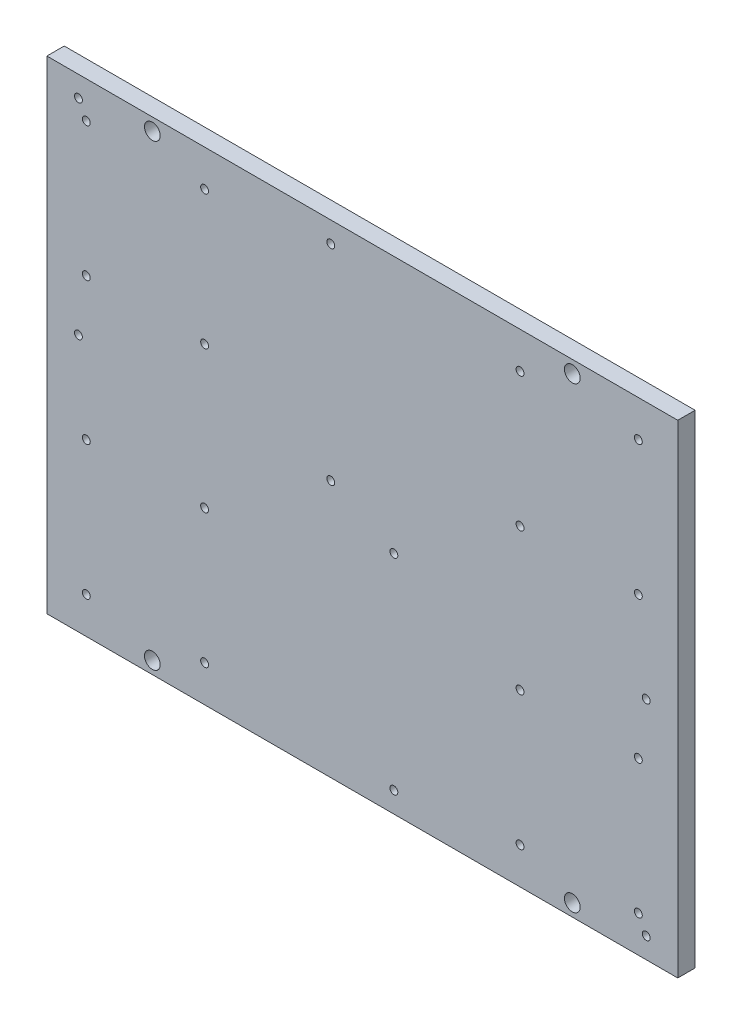
from build123d import *

# Parameters (mm, degrees)
SKETCH1_W             = 203.2
SKETCH1_H             = 155.575
BOSS_EXTRUDE1_DEPTH   = 5.588
SKETCH2_R             = 2.54
CUT_EXTRUDE1_DEPTH    = 129.08075929
SKETCH3_R             = 1.27
H_BRIDGE_MOUNTS_DEPTH = 129.08075929
SKETCH4_R             = 1.27
MOTO_MOUNTS_DEPTH     = 129.08075929


with BuildPart() as part:
    # Sketch1 → Boss-Extrude1 (new body)
    with BuildSketch(Plane.XY):
        Rectangle(SKETCH1_W, SKETCH1_H)
    extrude(amount=BOSS_EXTRUDE1_DEPTH)

    # Sketch2 → Cut-Extrude1 (cut, through all)
    with BuildSketch(Plane.XY.offset(5.588)):
        with Locations((-67.6275, 73.787)):
            Circle(SKETCH2_R)
        with Locations(Location((67.6275, 73.787, 0), (0, 0, 180))):
            Circle(SKETCH2_R)
        with Locations((67.6275, -73.787)):
            Circle(SKETCH2_R)
        with Locations(Location((-67.6275, -73.787, 0), (0, 0, 180))):
            Circle(SKETCH2_R)
    extrude(amount=-CUT_EXTRUDE1_DEPTH, mode=Mode.SUBTRACT)

    # Sketch3 → H-Bridge_Mounts (cut, through all)
    with BuildSketch(Plane.XY.offset(5.588)):
        with Locations((-91.44, 71.12)):
            Circle(SKETCH3_R)
        with Locations((-10.16, 71.12)):
            Circle(SKETCH3_R)
        with Locations((-10.16, 5.08)):
            Circle(SKETCH3_R)
        with Locations((-91.44, 5.08)):
            Circle(SKETCH3_R)
        with Locations((10.16, -5.08)):
            Circle(SKETCH3_R)
        with Locations((91.44, -71.12)):
            Circle(SKETCH3_R)
        with Locations((91.44, -5.08)):
            Circle(SKETCH3_R)
        with Locations((10.16, -71.12)):
            Circle(SKETCH3_R)
    extrude(amount=-H_BRIDGE_MOUNTS_DEPTH, mode=Mode.SUBTRACT)

    # Sketch4 → Moto_Mounts (cut, through all)
    with BuildSketch(Plane.XY.offset(5.588)):
        with Locations((50.8, 22.86)):
            Circle(SKETCH4_R)
        with Locations((50.8, 66.04)):
            Circle(SKETCH4_R)
        with Locations((88.9, 66.04)):
            Circle(SKETCH4_R)
        with Locations(Location((-88.9, 22.86, 0), (0, 0, 180))):
            Circle(SKETCH4_R)
        with Locations(Location((-88.9, 66.04, 0), (0, 0, 180))):
            Circle(SKETCH4_R)
        with Locations(Location((-50.8, 66.04, 0), (0, 0, 180))):
            Circle(SKETCH4_R)
        with Locations(Location((-50.8, 22.86, 0), (0, 0, 180))):
            Circle(SKETCH4_R)
        with Locations(Location((88.9, -22.86, 0), (0, 0, 180))):
            Circle(SKETCH4_R)
        with Locations((-50.8, -22.86)):
            Circle(SKETCH4_R)
        with Locations((-50.8, -66.04)):
            Circle(SKETCH4_R)
        with Locations((-88.9, -66.04)):
            Circle(SKETCH4_R)
        with Locations((-88.9, -22.86)):
            Circle(SKETCH4_R)
        with Locations((88.9, 22.86)):
            Circle(SKETCH4_R)
        with Locations(Location((88.9, -66.04, 0), (0, 0, 180))):
            Circle(SKETCH4_R)
        with Locations(Location((50.8, -66.04, 0), (0, 0, 180))):
            Circle(SKETCH4_R)
        with Locations(Location((50.8, -22.86, 0), (0, 0, 180))):
            Circle(SKETCH4_R)
    extrude(amount=-MOTO_MOUNTS_DEPTH, mode=Mode.SUBTRACT)


solid = part.part
